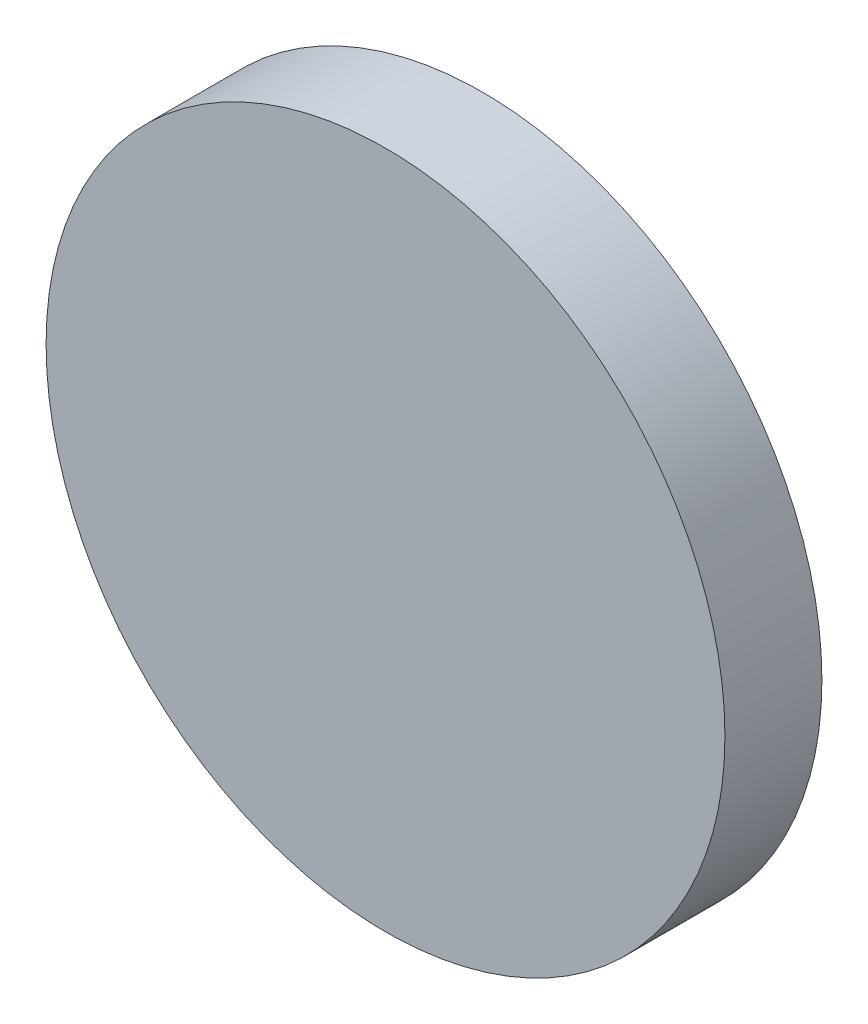
from build123d import *

# Parameters (mm, degrees)
SKETCH1_R           = 3.5
BOSS_EXTRUDE1_DEPTH = 1


with BuildPart() as part:
    # Sketch1 → Boss-Extrude1 (new body)
    with BuildSketch(Plane.XY):
        Circle(SKETCH1_R)
    extrude(amount=BOSS_EXTRUDE1_DEPTH)


solid = part.part
